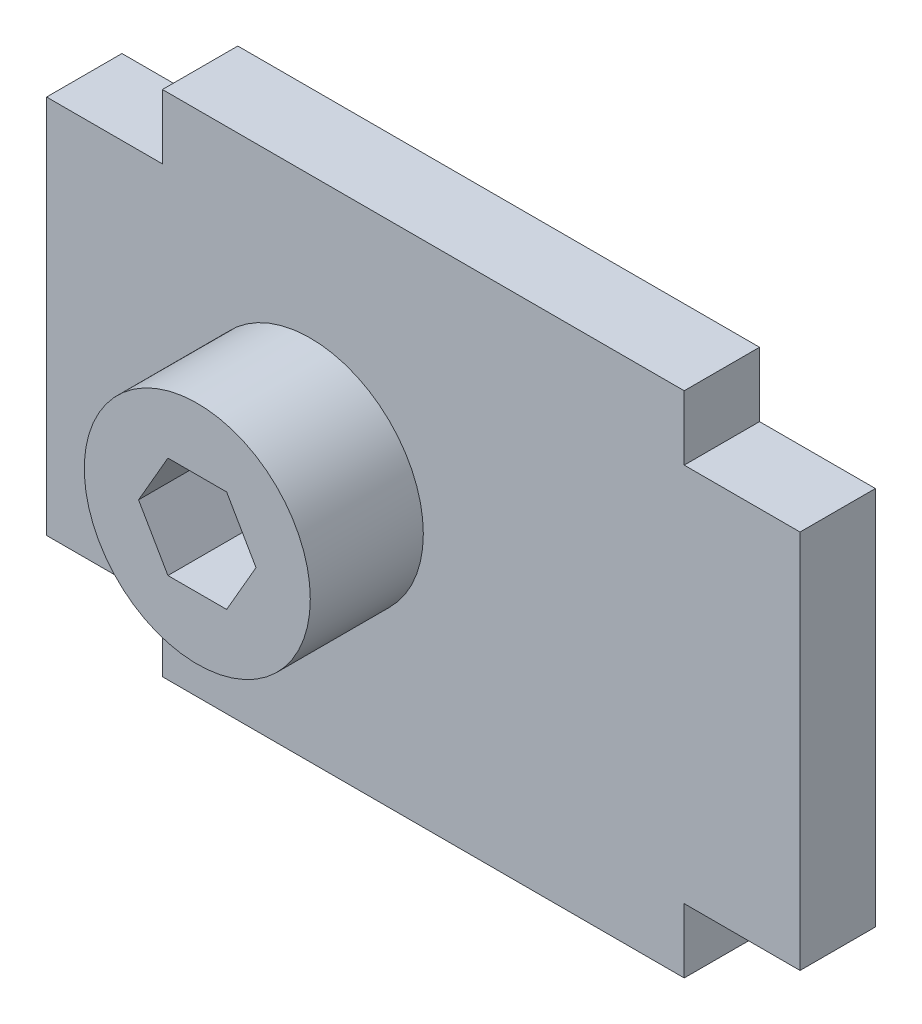
from build123d import *

# Parameters (mm, degrees)
EXTRUDE_1_DEPTH     = 4
SKETCH_2_R          = 1.6
CUT_EXTRUDE_1_DEPTH = 68.670041634
SKETCH_3_R          = 6
EXTRUDE_2_DEPTH     = 6


with BuildPart() as part:
    # 草图1 → 凸台-拉伸1 (new body)
    with BuildSketch(Plane.XY):
        Polygon((58.413097366, -10.348521791), (52.263097366, -10.348521791), (52.263097366, -6.928521791), (24.563097366, -6.928521791), (24.563097366, -10.348521791), (18.413097366, -10.348521791), (18.413097366, -30.508521791), (24.563097366, -30.508521791), (24.563097366, -33.928521791), (52.263097366, -33.928521791), (52.263097366, -30.508521791), (58.413097366, -30.508521791), align=None)
    extrude(amount=EXTRUDE_1_DEPTH)

    # 草图2 → 切除-拉伸1 (cut, through all)
    with BuildSketch(Plane.XY.offset(4)):
        with Locations((32.413097366, -20.428521791)):
            Circle(SKETCH_2_R)
    extrude(amount=-CUT_EXTRUDE_1_DEPTH, mode=Mode.SUBTRACT)

    # 草图3 → 凸台-拉伸2 (add)
    with BuildSketch(Plane.XY.offset(4)):
        with Locations((32.413097366, -20.428521791)):
            Circle(SKETCH_3_R)
        Polygon((33.971943092, -23.128521791), (35.530788819, -20.428521791), (33.971943092, -17.728521791), (30.854251639, -17.728521791), (29.295405912, -20.428521791), (30.854251639, -23.128521791), align=None, mode=Mode.SUBTRACT)
    extrude(amount=EXTRUDE_2_DEPTH)


solid = part.part
